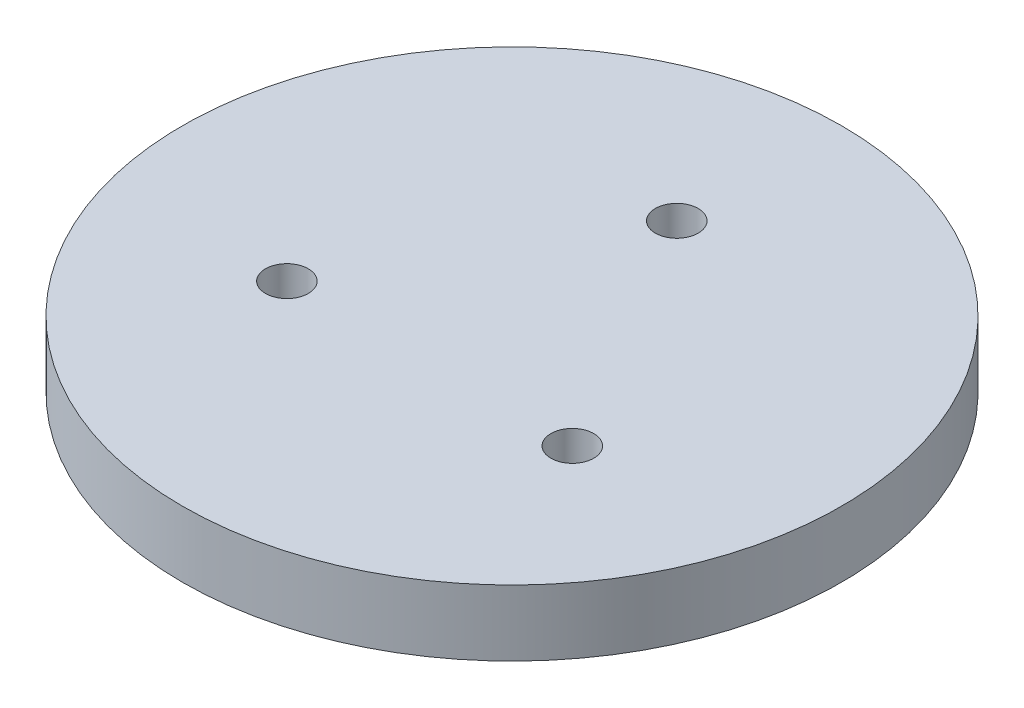
from build123d import *

# Parameters (mm, degrees)
SKETCH1_R           = 50
SKETCH1_R_2         = 3.25
BOSS_EXTRUDE1_DEPTH = 10


with BuildPart() as part:
    # Sketch1 → Boss-Extrude1 (new body)
    with BuildSketch(Plane(origin=(0, 0, 0), x_dir=(1, 0, 0), z_dir=(0, 1, 0))):
        with Locations(Location((0, 0, 0), (0, 0, 270))):
            Circle(SKETCH1_R)
        with Locations(Location((0, 25, 0), (0, 0, 270))):
            Circle(SKETCH1_R_2, mode=Mode.SUBTRACT)
        with Locations(Location((21.650635095, -12.5, 0), (0, 0, 270))):
            Circle(SKETCH1_R_2, mode=Mode.SUBTRACT)
        with Locations(Location((-21.650635095, -12.5, 0), (0, 0, 270))):
            Circle(SKETCH1_R_2, mode=Mode.SUBTRACT)
    extrude(amount=BOSS_EXTRUDE1_DEPTH)


solid = part.part
